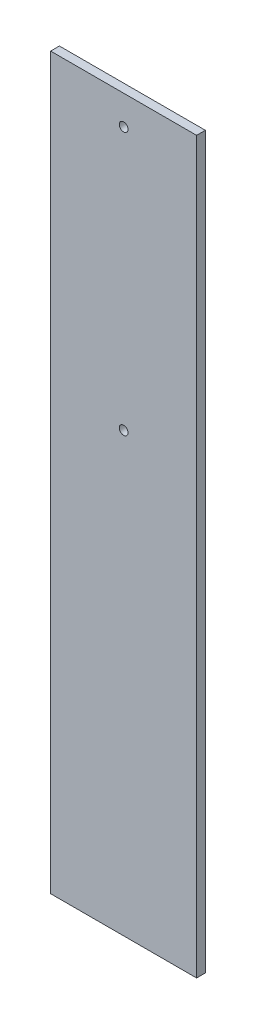
from build123d import *

# Parameters (mm, degrees)
SKETCH1_W           = 50
SKETCH1_H           = 250
SKETCH1_R           = 1.5
BOSS_EXTRUDE1_DEPTH = 3


with BuildPart() as part:
    # Sketch1 → Boss-Extrude1 (new body)
    with BuildSketch(Plane.XY):
        Rectangle(SKETCH1_W, SKETCH1_H)
        with Locations((0, 115)):
            Circle(SKETCH1_R, mode=Mode.SUBTRACT)
        with Locations((0, 25)):
            Circle(SKETCH1_R, mode=Mode.SUBTRACT)
    extrude(amount=BOSS_EXTRUDE1_DEPTH)


solid = part.part
